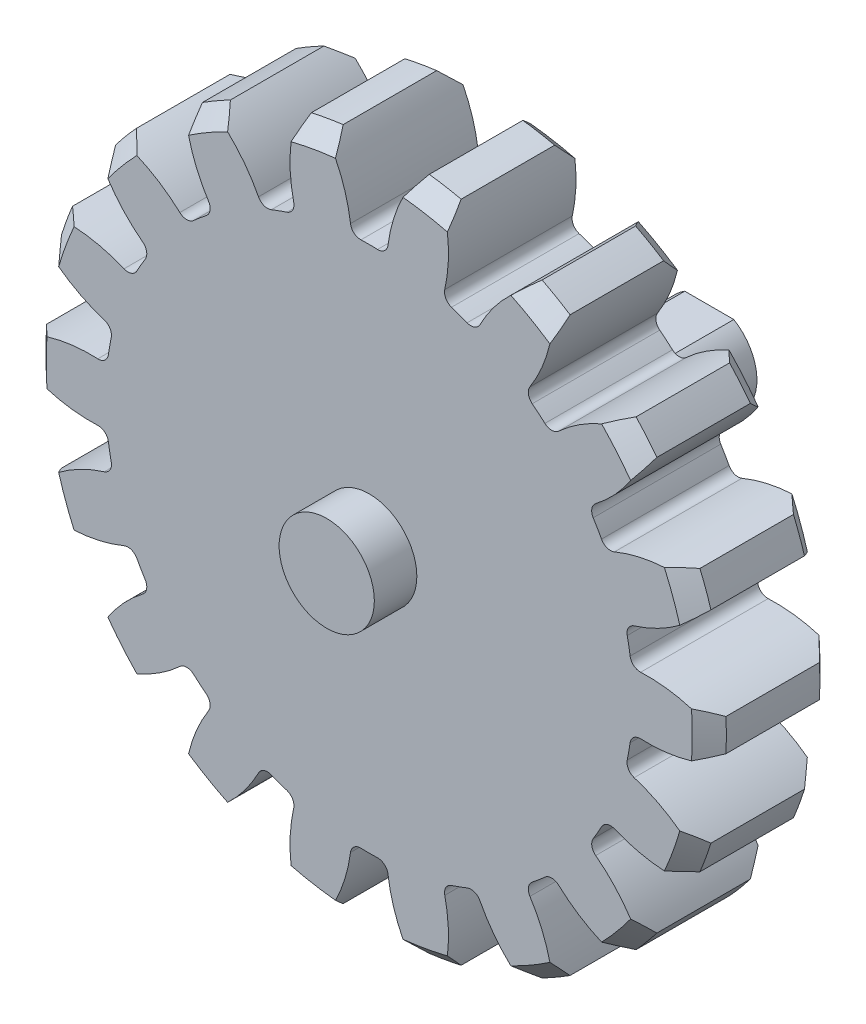
from build123d import *

# Parameters (mm, degrees)
SKICA1_R                     = 20
P_IDAT_VYSUNUT_M1_DEPTH      = 7.5
ODEBRAT_VYSUNUT_M1_DEPTH     = 7.5
ZAOBLIT2_R                   = 0.6
ZKOSEN_1_SIZE                = 1
KRUHOV_POLE1_COUNT           = 18
ZAOBLIT2_OF_KRUHOV_POLE1_R   = 0.6
P_IDAT_VYSUNUT_M2_DEPTH      = 10
P_IDAT_VYSUNUT_M2_DEPTH_BACK = 12.5
SKICA3_R                     = 2.8
ODEBRAT_VYSUNUT_M2_DEPTH     = 10


with BuildPart() as part:
    # Skica1 → Přidat vysunutím1 (new body)
    with BuildSketch(Plane.XY):
        Circle(SKICA1_R)
    extrude(amount=P_IDAT_VYSUNUT_M1_DEPTH)

    # Skica2 → Odebrat vysunutím1 (cut)
    with BuildSketch(Plane.XY):
        with BuildLine():
            ThreePointArc((1.04727229, 15.464579553), (0, 15.5), (-1.04727229, 15.464579553))
            ThreePointArc((-1.04727229, 15.464579553), (-1.50454186, 17.748849698), (-2.533487574, 19.838887083))
            ThreePointArc((-2.533487574, 19.838887083), (0, 20), (2.533487574, 19.838887083))
            ThreePointArc((2.533487574, 19.838887083), (1.50454186, 17.748849698), (1.04727229, 15.464579553))
        make_face()
    odebrat_vysunut_m1 = extrude(amount=ODEBRAT_VYSUNUT_M1_DEPTH, mode=Mode.SUBTRACT)

    # Zaoblit2
    zaoblit2_edges = [part.edges().sort_by_distance(p)[0] for p in [
        (-1.04727229, 15.464579553, 3.75),
        (1.04727229, 15.464579553, 3.75),
    ]]
    fillet(zaoblit2_edges, radius=ZAOBLIT2_R)

    # Zkosení1
    zkosen_1_edges = [part.edges().sort_by_distance(p)[0] for p in [
        (0, -20, 0),
        (0, -20, 7.5),
    ]]
    chamfer(zkosen_1_edges, length=ZKOSEN_1_SIZE)

    # Kruhové pole1: Odebrat vysunutím1 ×18 about axis
    kruhov_pole1_axis = Axis((0, 0, 0), (0, 0, 1))
    for i in range(1, KRUHOV_POLE1_COUNT):
        add(odebrat_vysunut_m1.rotate(kruhov_pole1_axis, i * 360 / KRUHOV_POLE1_COUNT), mode=Mode.SUBTRACT)

    # Zaoblit2 of Kruhové pole1
    zaoblit2_of_kruhov_pole1_edges = [part.edges().sort_by_distance(p)[0] for p in [
        (-6.273311758, 14.173763071, 3.75),
        (-4.305083672, 14.890139508, 3.75),
        (-10.742697244, 11.17338158, 3.75),
        (-9.138183008, 12.519728884, 3.75),
        (-13.916354897, 6.825325369, 3.75),
        (-12.869082607, 8.639254184, 3.75),
        (-15.411494766, 1.654034187, 3.75),
        (-15.047780916, 3.716757928, 3.75),
        (-15.047780916, -3.716757928, 3.75),
        (-15.411494766, -1.654034187, 3.75),
        (-12.869082607, -8.639254184, 3.75),
        (-13.916354897, -6.825325369, 3.75),
        (-9.138183008, -12.519728884, 3.75),
        (-10.742697244, -11.17338158, 3.75),
        (-4.305083672, -14.890139508, 3.75),
        (-6.273311758, -14.173763071, 3.75),
        (1.04727229, -15.464579553, 3.75),
        (-1.04727229, -15.464579553, 3.75),
        (6.273311758, -14.173763071, 3.75),
        (4.305083672, -14.890139508, 3.75),
        (10.742697244, -11.17338158, 3.75),
        (9.138183008, -12.519728884, 3.75),
        (13.916354897, -6.825325369, 3.75),
        (12.869082607, -8.639254184, 3.75),
        (15.411494766, -1.654034187, 3.75),
        (15.047780916, -3.716757928, 3.75),
        (15.047780916, 3.716757928, 3.75),
        (15.411494766, 1.654034187, 3.75),
        (12.869082607, 8.639254184, 3.75),
        (13.916354897, 6.825325369, 3.75),
        (9.138183008, 12.519728884, 3.75),
        (10.742697244, 11.17338158, 3.75),
        (4.305083672, 14.890139508, 3.75),
        (6.273311758, 14.173763071, 3.75),
    ]]
    fillet(zaoblit2_of_kruhov_pole1_edges, radius=ZAOBLIT2_OF_KRUHOV_POLE1_R)

    # Skica3 → Přidat vysunutím2 (add, two sides: drawn at the far end of the back side and taken through both)
    with BuildSketch(Plane.XY.offset(-P_IDAT_VYSUNUT_M2_DEPTH_BACK)):
        Circle(SKICA3_R)
    extrude(amount=P_IDAT_VYSUNUT_M2_DEPTH + P_IDAT_VYSUNUT_M2_DEPTH_BACK)

    # Skica4 → Odebrat vysunutím2 (cut)
    with BuildSketch(Plane(origin=(0, 0, -12.5), x_dir=(-1, 0, 0), z_dir=(0, 0, -1))):
        Polygon((-73.226908835, 2.4), (-1.44222051, 2.4), (1.44222051, 2.4), (73.226908835, 2.4), (73.226908835, 145.96937665), (-73.226908835, 145.96937665), align=None)
    extrude(amount=-ODEBRAT_VYSUNUT_M2_DEPTH, mode=Mode.SUBTRACT)


solid = part.part
